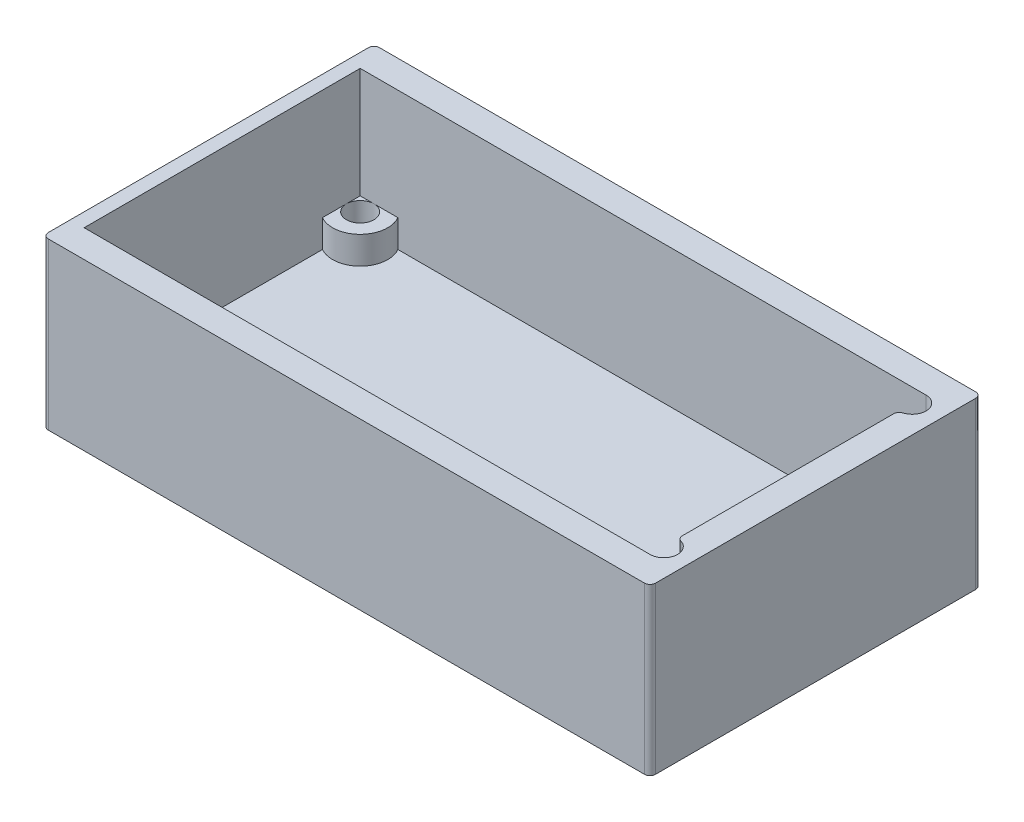
from build123d import *
from build123d.topology import SkipClean

# Parameters (mm, degrees)
SKETCH1_W               = 22
SKETCH1_H               = 12
BOSS_EXTRUDE1_DEPTH     = 6
FILLET1_R               = 0.2
SKETCH2_W               = 20.5
SKETCH2_H               = 10
CUT_EXTRUDE1_DEPTH      = 5
SKETCH3_R               = 1
SKETCH3_R_2             = 0.5
BOSS_EXTRUDE2_DEPTH     = 1
SKETCH7_R               = 1
SKETCH7_R_2             = 0.5
BOSS_EXTRUDE3_DEPTH     = 1
SKETCH8_R               = 0.5
CUT_EXTRUDE4_DEPTH      = 14.892443989
FILLET2_R               = 0.2
MIRROR5_COPY_1_SKETCH_R = 0.5
MIRROR5_COPY_1_DEPTH    = 14.892443989
SKETCH9_R               = 0.9
CUT_EXTRUDE12_DEPTH     = 1
MIRROR7_COPY_1_SKETCH_R = 0.9
MIRROR7_COPY_1_DEPTH    = 1


with BuildPart() as part:
    # Sketch1 → Boss-Extrude1 (new body)
    with BuildSketch(Plane(origin=(0, 0, 0), x_dir=(1, 0, 0), z_dir=(0, 1, 0))):
        Rectangle(SKETCH1_W, SKETCH1_H)
    extrude(amount=BOSS_EXTRUDE1_DEPTH)

    # Fillet1
    fillet1_edges = [part.edges().sort_by_distance(p)[0] for p in [
        (11, 3, 6),
        (-11, 3, 6),
        (-11, 3, -6),
        (11, 3, -6),
    ]]
    fillet(fillet1_edges, radius=FILLET1_R)

    # Sketch2 → Cut-Extrude1 (cut)
    with BuildSketch(Plane(origin=(0, 6, 0), x_dir=(1, 0, 0), z_dir=(0, 1, 0))):
        with Locations((-0.25, 0)):
            Rectangle(SKETCH2_W, SKETCH2_H)
    extrude(amount=-CUT_EXTRUDE1_DEPTH, mode=Mode.SUBTRACT)

    # Sketch3 → Boss-Extrude2 (add)
    with BuildSketch(Plane(origin=(0, 1, 0), x_dir=(1, 0, 0), z_dir=(0, 1, 0))):
        with Locations((10, 4.5)):
            Circle(SKETCH3_R)
        with Locations((10, 4.5)):
            Circle(SKETCH3_R_2, mode=Mode.SUBTRACT)
    boss_extrude2 = extrude(amount=BOSS_EXTRUDE2_DEPTH)

    # Mirror1: Boss-Extrude2 across plane
    add(boss_extrude2.mirror(Plane.XY))

    # Sketch7 → Boss-Extrude3 (add)
    with BuildSketch(Plane(origin=(0, 1, 0), x_dir=(1, 0, 0), z_dir=(0, 1, 0))):
        with Locations((-10, 4.5)):
            Circle(SKETCH7_R)
        with Locations(Location((-10, 4.5, 0), (0, 0, 90))):
            Circle(SKETCH7_R_2, mode=Mode.SUBTRACT)
    boss_extrude3 = extrude(amount=BOSS_EXTRUDE3_DEPTH)

    # Mirror3: Boss-Extrude3 across plane
    add(boss_extrude3.mirror(Plane.XY))

    # Sketch8 → Cut-Extrude4 (cut, through all)
    with SkipClean():  # the faces are left unmerged after this step: merging them gives an invalid solid
        with BuildSketch(Plane(origin=(0, 6, 0), x_dir=(1, 0, 0), z_dir=(0, 1, 0))):
            with Locations(Location((10, 4.5, 0), (0, 0, 270))):
                Circle(SKETCH8_R)
        cut_extrude4 = extrude(amount=-CUT_EXTRUDE4_DEPTH, mode=Mode.SUBTRACT)

    # Mirror4: Cut-Extrude4 across plane
    with SkipClean():  # the faces are left unmerged after this step: merging them gives an invalid solid
        add(cut_extrude4.mirror(Plane.XY), mode=Mode.SUBTRACT)

    # Fillet2
    fillet2_edges = [part.edges().sort_by_distance(p)[0] for p in [
        (10, 4, -4),
        (10, 4, 4),
    ]]
    fillet(fillet2_edges, radius=FILLET2_R)

    # Mirror5: Cut-Extrude4 across plane
    with SkipClean():  # the faces are left unmerged after this step: merging them gives an invalid solid
        add(cut_extrude4.mirror(Plane(origin=(0, 0, 0), x_dir=(0, 0, 1), z_dir=(1, 0, 0))), mode=Mode.SUBTRACT)

    # Mirror5 copy 1 sketch → Mirror5 copy 1 (cut, through all)
    with SkipClean():  # the faces are left unmerged after this step: merging them gives an invalid solid
        with BuildSketch(Plane(origin=(0, 6, 0), x_dir=(-1, 0, 0), z_dir=(0, 1, 0))):
            with Locations(Location((10, 4.5, 0), (0, 0, 270))):
                Circle(MIRROR5_COPY_1_SKETCH_R)
        extrude(amount=-MIRROR5_COPY_1_DEPTH, mode=Mode.SUBTRACT)

    # Sketch9 → Cut-Extrude12 (cut)
    with SkipClean():  # the faces are left unmerged after this step: merging them gives an invalid solid
        with BuildSketch(Plane(origin=(0, 0, 0), x_dir=(-1, 0, 0), z_dir=(0, -1, 0))):
            with Locations(Location((-10, -4.5, 0), (0, 0, 90))):
                Circle(SKETCH9_R)
        cut_extrude12 = extrude(amount=-CUT_EXTRUDE12_DEPTH, mode=Mode.SUBTRACT)

    # Mirror6: Cut-Extrude12 across plane
    with SkipClean():  # the faces are left unmerged after this step: merging them gives an invalid solid
        add(cut_extrude12.mirror(Plane(origin=(0, 0, 0), x_dir=(0, 0, 1), z_dir=(1, 0, 0))), mode=Mode.SUBTRACT)

    # Mirror7: Cut-Extrude12 across plane
    add(cut_extrude12.mirror(Plane.XY), mode=Mode.SUBTRACT)

    # Mirror7 copy 1 sketch → Mirror7 copy 1 (cut)
    with SkipClean():  # the faces are left unmerged after this step: merging them gives an invalid solid
        with BuildSketch(Plane.XZ):
            with Locations(Location((-10, -4.5, 0), (0, 0, 90))):
                Circle(MIRROR7_COPY_1_SKETCH_R)
        extrude(amount=-MIRROR7_COPY_1_DEPTH, mode=Mode.SUBTRACT)


solid = part.part
